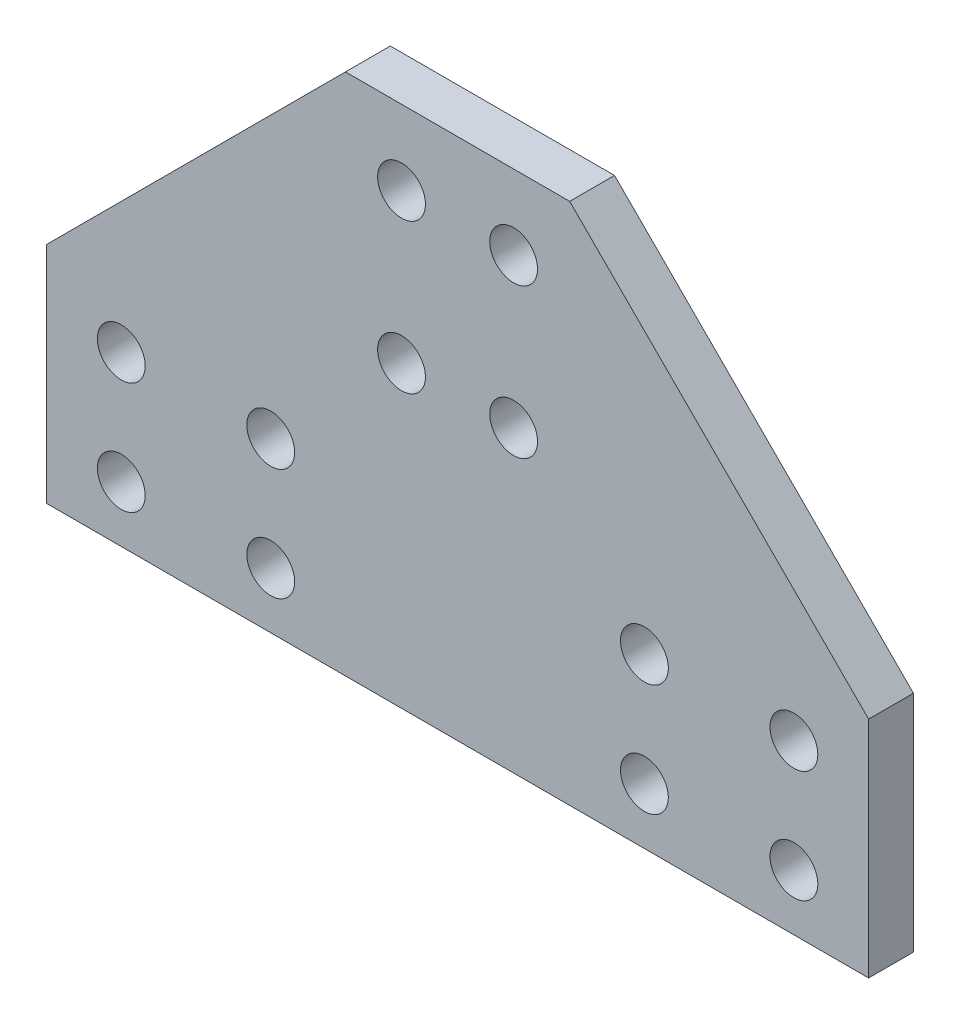
from build123d import *

# Parameters (mm, degrees)
EXTRUDE_1_DEPTH     = 3
SKETCH_2_R          = 1.6
CUT_EXTRUDE_1_DEPTH = 50.588305073


with BuildPart() as part:
    # 草图1 → 凸台-拉伸1 (new body)
    with BuildSketch(Plane.XY):
        Polygon((0, 0), (15, 0), (35, -20), (35, -35), (-20, -35), (-20, -20), align=None)
    extrude(amount=EXTRUDE_1_DEPTH)

    # 草图2 → 切除-拉伸1 (cut, through all)
    with BuildSketch(Plane.XY.offset(3)):
        with Locations((-15, -31.25)):
            Circle(SKETCH_2_R)
        with Locations(Location((-15, -23.75, 0), (0, 0, 180))):
            Circle(SKETCH_2_R)
        with Locations(Location((-5, -31.25, 0), (0, 0, 180))):
            Circle(SKETCH_2_R)
        with Locations((-5, -23.75)):
            Circle(SKETCH_2_R)
        with Locations((20, -31.25)):
            Circle(SKETCH_2_R)
        with Locations(Location((30, -31.25, 0), (0, 0, 180))):
            Circle(SKETCH_2_R)
        with Locations(Location((20, -23.75, 0), (0, 0, 180))):
            Circle(SKETCH_2_R)
        with Locations((30, -23.75)):
            Circle(SKETCH_2_R)
        with Locations((3.75, -5)):
            Circle(SKETCH_2_R)
        with Locations(Location((11.25, -5, 0), (0, 0, 180))):
            Circle(SKETCH_2_R)
        with Locations((11.25, -15)):
            Circle(SKETCH_2_R)
        with Locations(Location((3.75, -15, 0), (0, 0, 180))):
            Circle(SKETCH_2_R)
    extrude(amount=-CUT_EXTRUDE_1_DEPTH, mode=Mode.SUBTRACT)


solid = part.part
